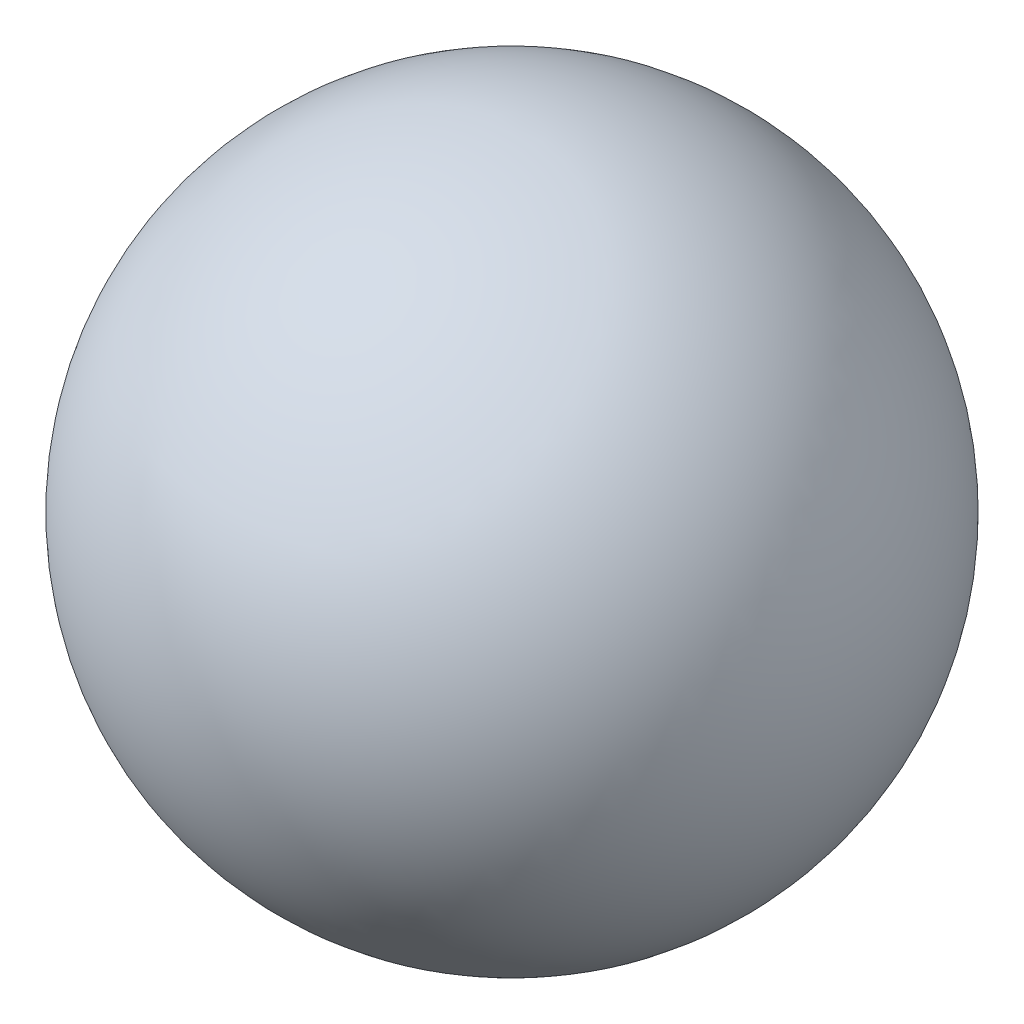
from build123d import *


with BuildPart() as part:
    # Sketch1 → True_Sphere_D5.05 (revolve)
    with BuildSketch(Plane.XY):
        with BuildLine():
            Line((0, -2.525), (0, 2.525))
            ThreePointArc((0, 2.525), (2.525, 0), (0, -2.525))
        make_face()
    revolve(axis=Axis((0, -2.525, 0), (0, 1, 0)))


solid = part.part
